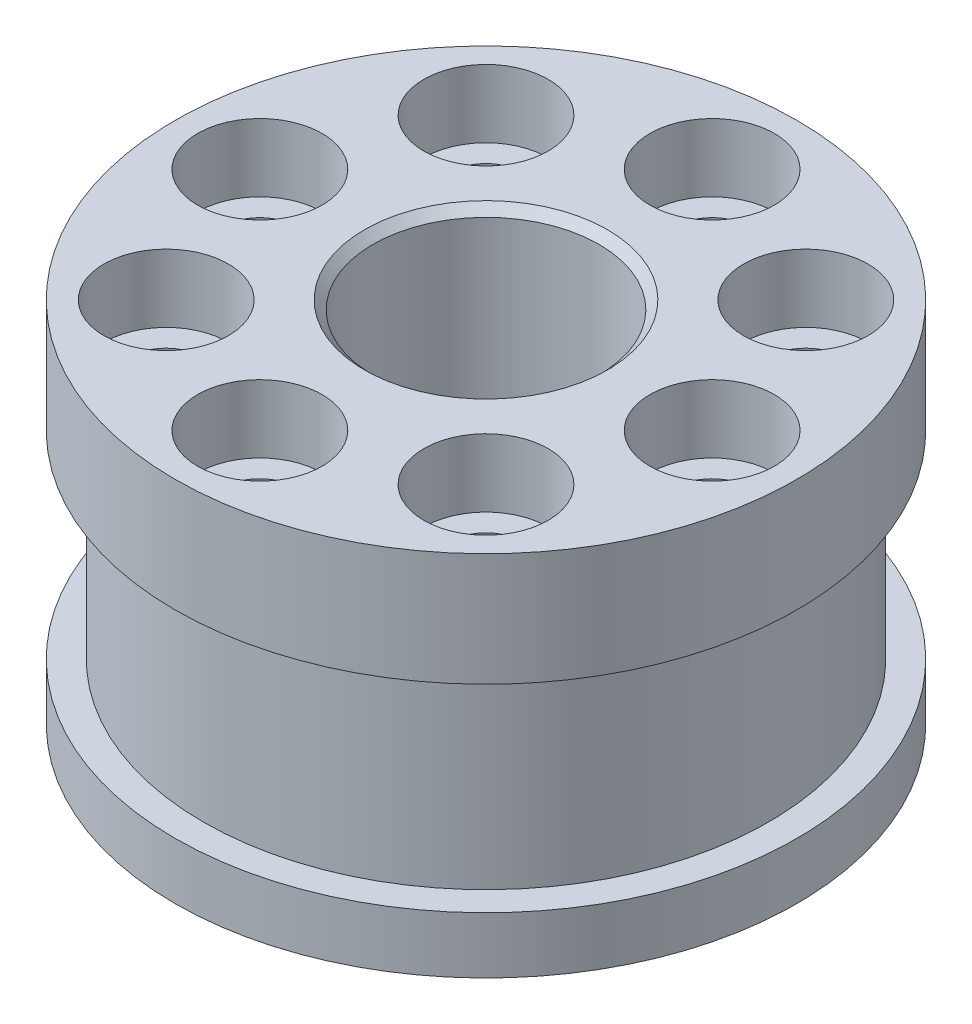
from build123d import *

# Parameters (mm, degrees)
SKETCH1_R                                           = 11
BOSS_EXTRUDE1_DEPTH                                 = 13
CBORE_FOR_M2_HEX_SOCKET_HEAD_CAP_SCREW1_D           = 2.6
CBORE_FOR_M2_HEX_SOCKET_HEAD_CAP_SCREW1_CBORE_D     = 4.4
CBORE_FOR_M2_HEX_SOCKET_HEAD_CAP_SCREW1_CBORE_DEPTH = 2.4
CUT_EXTRUDE1_START                                  = -2
SKETCH8_R                                           = 11
SKETCH8_R_2                                         = 10
CUT_EXTRUDE1_DEPTH                                  = 7


with BuildPart() as part:
    # Sketch1 → Boss-Extrude1 (new body)
    with BuildSketch(Plane(origin=(0, 0, 0), x_dir=(1, 0, 0), z_dir=(0, 1, 0))):
        with Locations(Location((0, 0, 0), (0, 0, 90))):
            Circle(SKETCH1_R)
    extrude(amount=BOSS_EXTRUDE1_DEPTH)

    # CBORE for M2 Hex Socket Head Cap Screw1 (through all)
    with Locations(Plane(origin=(0, 13, 0), x_dir=(1, 0, 0), z_dir=(0, 1, 0))):
        with Locations((-5.656854249, 5.656854249), (0, 8), (5.656854249, 5.656854249), (8, 0), (5.656854249, -5.656854249), (0, -8), (-5.656854249, -5.656854249), (-8, 0)):
            CounterBoreHole(CBORE_FOR_M2_HEX_SOCKET_HEAD_CAP_SCREW1_D / 2, CBORE_FOR_M2_HEX_SOCKET_HEAD_CAP_SCREW1_CBORE_D / 2, CBORE_FOR_M2_HEX_SOCKET_HEAD_CAP_SCREW1_CBORE_DEPTH)

    # Sketch8 → Cut-Extrude1 (cut)
    with BuildSketch(Plane.XZ.offset(CUT_EXTRUDE1_START)):
        with Locations(Location((0, 0, 0), (0, 0, 270))):
            Circle(SKETCH8_R)
        with Locations(Location((0, 0, 0), (0, 0, 270))):
            Circle(SKETCH8_R_2, mode=Mode.SUBTRACT)
    extrude(amount=-CUT_EXTRUDE1_DEPTH, mode=Mode.SUBTRACT)

    # Sketch12 → Ø8.0mm Dowel Hole1 (revolve, cut)
    with BuildSketch(Plane(origin=(0, 0, 0), x_dir=(0, 0, -1), z_dir=(1, 0, 0))):
        Polygon((0, 0), (0, 13), (4.3, 13), (4, 12.7), (4, 0.3), (4.3, 0), align=None)
    revolve(axis=Axis((0, -6.35, 0), (0, 1, 0)), mode=Mode.SUBTRACT)


solid = part.part
